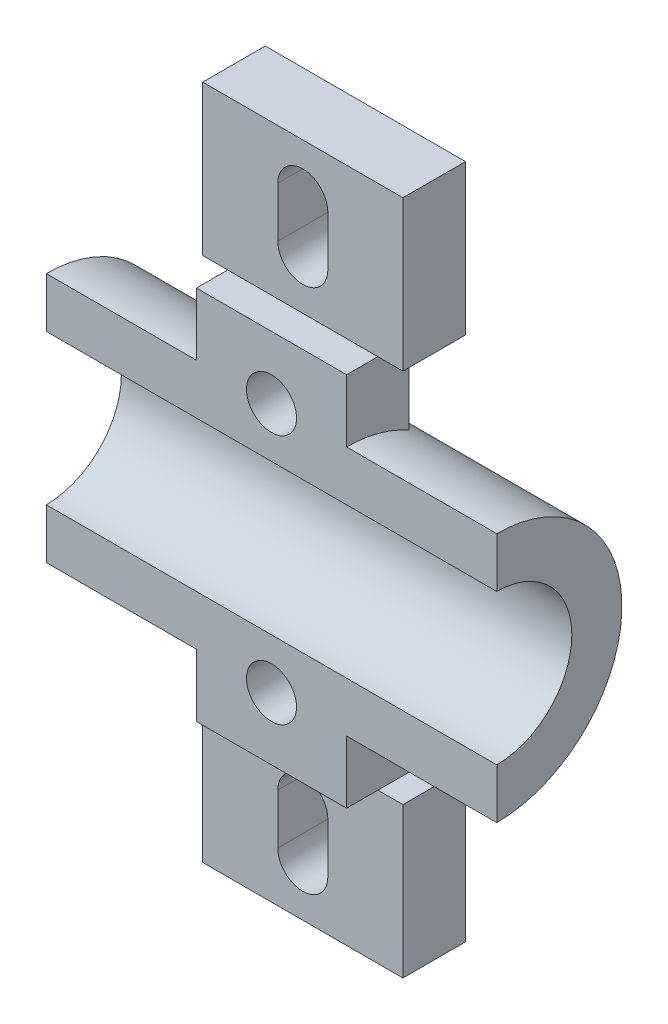
from build123d import *

# Parameters (mm, degrees)
BOSS_EXTRUDE1_DEPTH     = 72
SKETCH2_W               = 48
SKETCH2_H               = 20
BOSS_EXTRUDE2_DEPTH     = 120
CUT_EXTRUDE1_DEPTH      = 121.066648158
CUT_EXTRUDE1_DEPTH_BACK = 121.066648158
SKETCH4_R               = 24
SKETCH5_W               = 64
SKETCH5_H               = 20
BOSS_EXTRUDE3_DEPTH     = 48
CUT_EXTRUDE2_DEPTH      = 136.823414771
CUT_EXTRUDE2_DEPTH_BACK = 136.823414771
SKETCH6_R               = 8


with BuildPart() as part:
    # Sketch1 → Boss-Extrude1 (new, symmetric)
    with BuildSketch(Plane.YZ):
        with BuildLine():
            Line((-40, 0), (-24, 0))
            ThreePointArc((-24, 0), (0, -24), (24, 0))
            Line((24, 0), (40, 0))
            ThreePointArc((40, 0), (0, -40), (-40, 0))
        make_face()
    extrude(amount=BOSS_EXTRUDE1_DEPTH, both=True)

    # Sketch2 → Boss-Extrude2 (add)
    with BuildSketch(Plane(origin=(0, 60, 0), x_dir=(-1, 0, 0), z_dir=(0, 1, 0))):
        with Locations((0, -10)):
            Rectangle(SKETCH2_W, SKETCH2_H)
    extrude(amount=-BOSS_EXTRUDE2_DEPTH)

    # Sketch4 → Cut-Extrude1 (cut, two sides: drawn at the far end of the back side and taken through both)
    with BuildSketch(Plane.YZ.offset(24).offset(-CUT_EXTRUDE1_DEPTH_BACK)):
        Circle(SKETCH4_R)
    extrude(amount=CUT_EXTRUDE1_DEPTH + CUT_EXTRUDE1_DEPTH_BACK, mode=Mode.SUBTRACT)

    # Sketch5 → Boss-Extrude3 (add)
    with BuildSketch(Plane(origin=(0, 60, 0), x_dir=(-1, 0, 0), z_dir=(0, 1, 0))):
        with Locations((0, -20)):
            Rectangle(SKETCH5_W, SKETCH5_H)
    boss_extrude3 = extrude(amount=BOSS_EXTRUDE3_DEPTH)

    # Mirror1: Boss-Extrude3 across plane
    add(boss_extrude3.mirror(Plane.ZX))

    # Sketch6 → Cut-Extrude2 (cut, two sides: drawn at the far end of the back side and taken through both)
    with BuildSketch(Plane.XY.offset(-CUT_EXTRUDE2_DEPTH_BACK)):
        with Locations(Location((0, 40, 0), (0, 0, 317.942751882))):
            Circle(SKETCH6_R)
        with Locations(Location((0, -40, 0), (0, 0, 42.057262179))):
            Circle(SKETCH6_R)
        with BuildLine():
            Line((8, 92), (8, 76))
            ThreePointArc((8, 76), (0, 68), (-8, 76))
            Line((-8, 76), (-8, 92))
            ThreePointArc((-8, 92), (0, 100), (8, 92))
        make_face()
        with BuildLine():
            Line((8, -92), (8, -76))
            ThreePointArc((8, -76), (0, -68), (-8, -76))
            Line((-8, -76), (-8, -92))
            ThreePointArc((-8, -92), (0, -100), (8, -92))
        make_face()
    extrude(amount=CUT_EXTRUDE2_DEPTH + CUT_EXTRUDE2_DEPTH_BACK, mode=Mode.SUBTRACT)


solid = part.part
